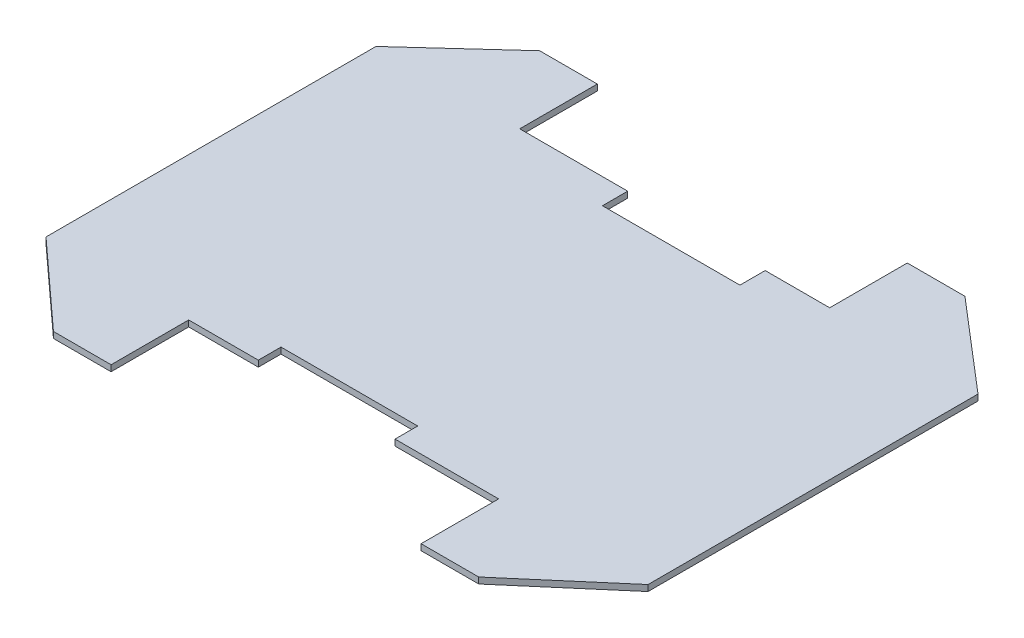
from build123d import *

# Parameters (mm, degrees)
EXTRUDE_1_DEPTH = 5.5


with BuildPart() as part:
    # Эскиз1 → Вытянуть1 (new body)
    with BuildSketch(Plane(origin=(0, 0, 0), x_dir=(1, 0, 0), z_dir=(0, 1, 0))):
        Polygon((-43.169767838, 75.141499308), (-43.169767838, 52.349234646), (80.875705743, 52.349234646), (80.875705743, 75.141499308), (139.068300868, 75.141499308), (139.068300868, 145.141499308), (191.068300868, 145.141499308), (273.341577689, 74.660680838), (273.341577689, -223.012011978), (191.068300868, -293.492830448), (139.068300868, -293.492830448), (139.068300868, -223.492830448), (45.587479179, -223.492830448), (45.587479179, -203.055820243), (-77.754429326, -203.055820243), (-77.754429326, -223.492830448), (-140.586469874, -223.492830448), (-140.586469874, -293.492830448), (-192.586469874, -293.492830448), (-269.7921816, -223.012011978), (-269.7921816, 74.660680838), (-192.586469874, 145.141499308), (-140.586469874, 145.141499308), (-140.586469874, 75.141499308), align=None)
    extrude(amount=EXTRUDE_1_DEPTH)


solid = part.part
